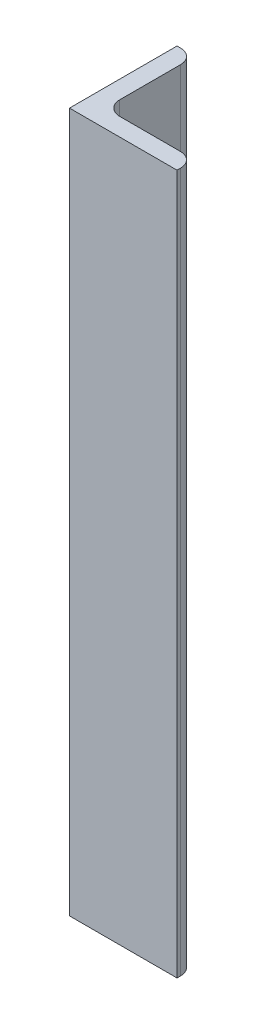
from build123d import *

# Parameters (mm, degrees)
BOSS_EXTRUDE1_DEPTH = 123.952
FILLET1_R           = 2.54


with BuildPart() as part:
    # Sketch1 → Boss-Extrude1 (new body)
    with BuildSketch(Plane(origin=(0, 0, 0), x_dir=(1, 0, 0), z_dir=(0, 1, 0))):
        Polygon((0, 0), (0, 19.05), (3.175, 19.05), (3.175, 3.175), (19.05, 3.175), (19.05, 0), align=None)
    extrude(amount=BOSS_EXTRUDE1_DEPTH)

    # Fillet1
    fillet1_edges = [part.edges().sort_by_distance(p)[0] for p in [
        (3.175, 61.976, -19.05),
        (3.175, 61.976, -3.175),
        (19.05, 61.976, -3.175),
    ]]
    fillet(fillet1_edges, radius=FILLET1_R)


solid = part.part
